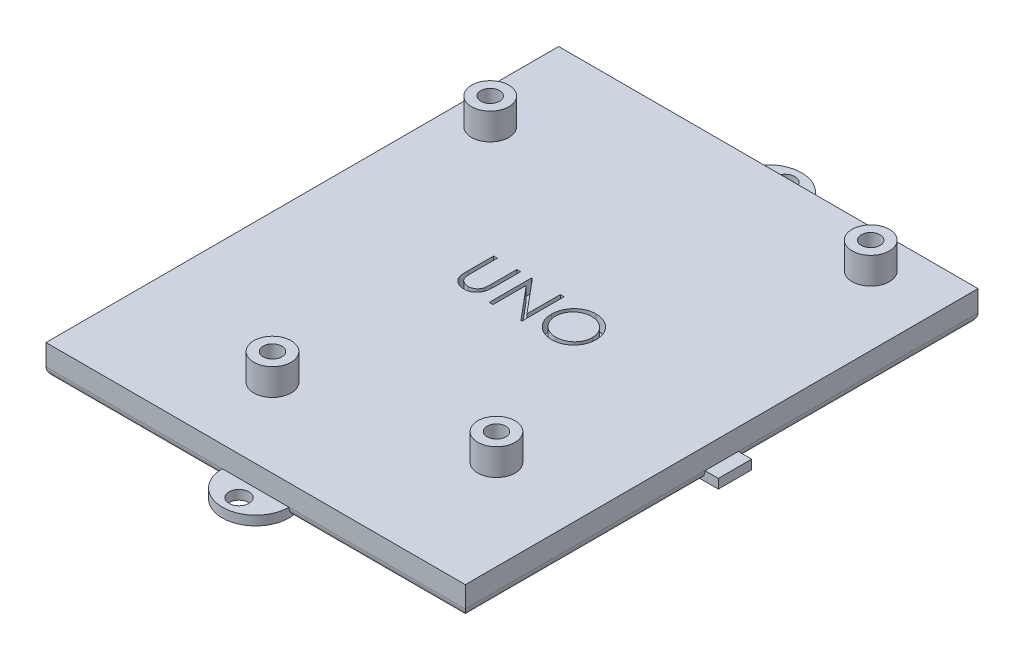
from build123d import *

# Parameters (mm, degrees)
SKETCH1_W           = 62.9
SKETCH1_H           = 76.9
BOSS_EXTRUDE1_DEPTH = 4.575
SKETCH2_R           = 2.7999972
SKETCH2_R_2         = 1.3999972
BOSS_EXTRUDE2_DEPTH = 4
CUT_EXTRUDE1_START  = -3.575
SKETCH3_R           = 1.3999972
CUT_EXTRUDE1_DEPTH  = 3.575
SKETCH4_R           = 1.5
BOSS_EXTRUDE3_DEPTH = 1.4
CUT_EXTRUDE2_DEPTH  = 2
SKETCH6_W           = 5
SKETCH6_H           = 1.4
BOSS_EXTRUDE4_DEPTH = 2
FILLET1_R           = 1.4


with BuildPart() as part:
    # Sketch1 → Boss-Extrude1 (new body)
    with BuildSketch(Plane(origin=(0, 0, 0), x_dir=(1, 0, 0), z_dir=(0, 1, 0))):
        Rectangle(SKETCH1_W, SKETCH1_H)
    extrude(amount=BOSS_EXTRUDE1_DEPTH)

    # Sketch2 → Boss-Extrude2 (add)
    # profile 1 of 4: a face of its own
    with BuildSketch(Plane(origin=(0, 4.575, 0), x_dir=(1, 0, 0), z_dir=(0, 1, 0))):
        with Locations(Location((17.897720407, -20.230856277, 0), (0, 0, 270))):
            Circle(SKETCH2_R)
        with Locations(Location((17.897720407, -20.230856277, 0), (0, 0, 270))):
            Circle(SKETCH2_R_2, mode=Mode.SUBTRACT)
    # profile 2 of 4: a face of its own
    with BuildSketch(Plane(origin=(0, 4.575, 0), x_dir=(1, 0, 0), z_dir=(0, 1, 0))):
        with Locations(Location((21.102904127, 32.70896236, 0), (0, 0, 270))):
            Circle(SKETCH2_R)
        with Locations(Location((21.102904127, 32.70896236, 0), (0, 0, 270))):
            Circle(SKETCH2_R_2, mode=Mode.SUBTRACT)
    # profile 3 of 4: a face of its own
    with BuildSketch(Plane(origin=(0, 4.575, 0), x_dir=(1, 0, 0), z_dir=(0, 1, 0))):
        with Locations(Location((-26.16610882, 22.896678476, 0), (0, 0, 270))):
            Circle(SKETCH2_R)
        with Locations(Location((-26.16610882, 22.896678476, 0), (0, 0, 270))):
            Circle(SKETCH2_R_2, mode=Mode.SUBTRACT)
    # profile 4 of 4: a face of its own
    with BuildSketch(Plane(origin=(0, 4.575, 0), x_dir=(1, 0, 0), z_dir=(0, 1, 0))):
        with Locations(Location((-9.300220478, -26.627387496, 0), (0, 0, 270))):
            Circle(SKETCH2_R)
        with Locations(Location((-9.300220478, -26.627387496, 0), (0, 0, 270))):
            Circle(SKETCH2_R_2, mode=Mode.SUBTRACT)
    extrude(amount=BOSS_EXTRUDE2_DEPTH)

    # Sketch3 → Cut-Extrude1 (cut)
    with BuildSketch(Plane(origin=(0, 4.575, 0), x_dir=(1, 0, 0), z_dir=(0, 1, 0)).offset(CUT_EXTRUDE1_START)):
        with Locations(Location((17.897720407, -20.230856277, 0), (0, 0, 270))):
            Circle(SKETCH3_R)
        with Locations(Location((-9.300220478, -26.627387496, 0), (0, 0, 270))):
            Circle(SKETCH3_R)
        with Locations(Location((-26.16610882, 22.896678476, 0), (0, 0, 270))):
            Circle(SKETCH3_R)
        with Locations(Location((21.102904127, 32.70896236, 0), (0, 0, 270))):
            Circle(SKETCH3_R)
    extrude(amount=CUT_EXTRUDE1_DEPTH, mode=Mode.SUBTRACT)

    # Sketch4 → Boss-Extrude3 (add)
    with BuildSketch(Plane(origin=(0, 0, 0), x_dir=(1, 0, 0), z_dir=(0, 1, 0))):
        with BuildLine():
            Line((-5, -38.45), (5, -38.45))
            ThreePointArc((5, -38.45), (0, -43.45), (-5, -38.45))
        make_face()
        with Locations(Location((0, -40.95, 0), (0, 0, 270))):
            Circle(SKETCH4_R, mode=Mode.SUBTRACT)
    boss_extrude3 = extrude(amount=BOSS_EXTRUDE3_DEPTH)

    # Mirror1: Boss-Extrude3 across plane
    add(boss_extrude3.mirror(Plane.XY))

    # Sketch5 → Cut-Extrude2 (cut)
    # profile 1 of 3: a face of its own
    with BuildSketch(Plane(origin=(0, 4.575, 0), x_dir=(1, 0, 0), z_dir=(0, 1, 0))):
        with BuildLine():
            Line((-9.117948718, 6.35), (-8.548076923, 6.35))
            Line((-8.548076923, 6.35), (-8.548076923, 2.545342548))
            add(Edge.make_bspline(
                [(-8.548076923, 2.545342548), (-8.54816173, 2.491493213), (-8.548322666, 2.389304821), (-8.547247676, 2.243856618), (-8.544237108, 2.114548014), (-8.542339076, 2.000880569), (-8.538116628, 1.90337587), (-8.534673028, 1.821505663), (-8.530245161, 1.75565761), (-8.524923648, 1.717229359), (-8.522636218, 1.700711138)],
                knots=[0, 0, 0, 0, 1.528628734, 2.90083645, 4.128790002, 5.200304208, 6.127813768, 6.898992206, 7.526736466, 8, 8, 8, 8], degree=3))
            add(Edge.make_bspline(
                [(-8.522636218, 1.700711138), (-8.513242828, 1.641117724), (-8.494985333, 1.525288773), (-8.448455476, 1.360355176), (-8.383472296, 1.211708102), (-8.30646849, 1.074709045), (-8.204990752, 0.953171206), (-8.083427195, 0.841208636), (-7.93614753, 0.743288362), (-7.772389002, 0.653751889), (-7.595885785, 0.581788096), (-7.415525345, 0.527371564), (-7.234018797, 0.494208417), (-7.112504898, 0.490368411), (-7.052163462, 0.488461538)],
                knots=[0, 0, 0, 0, 1.035780045, 2.013197591, 2.933192213, 3.817615948, 4.702609284, 5.640816605, 6.646850145, 7.73207398, 8.84249596, 9.914020372, 10.964143139, 12, 12, 12, 12], degree=3))
            add(Edge.make_bspline(
                [(-7.052163462, 0.488461538), (-7.000358818, 0.49040981), (-6.897048742, 0.494295099), (-6.743548503, 0.518355124), (-6.594051163, 0.561717579), (-6.447818501, 0.617669712), (-6.310747429, 0.691597485), (-6.18276147, 0.776997436), (-6.068526904, 0.87716574), (-5.964281679, 0.988019222), (-5.87350401, 1.113095716), (-5.794816367, 1.249671767), (-5.730362181, 1.399802725), (-5.698533214, 1.505311462), (-5.68218149, 1.559515224)],
                knots=[0, 0, 0, 0, 0.994687771, 1.983630487, 2.973142513, 3.978332533, 4.983357753, 5.956394766, 6.925816176, 7.893390482, 8.871859704, 9.88551698, 10.913711441, 12, 12, 12, 12], degree=3))
            add(Edge.make_bspline(
                [(-5.68218149, 1.559515224), (-5.676738406, 1.581919066), (-5.66460902, 1.631843855), (-5.653275096, 1.716246768), (-5.6414704, 1.815831757), (-5.63327968, 1.931314332), (-5.625294608, 2.062307525), (-5.620517462, 2.209493735), (-5.618309417, 2.372338506), (-5.617651411, 2.485980214), (-5.617307692, 2.545342548)],
                knots=[0, 0, 0, 0, 0.558680831, 1.244966039, 2.062412453, 2.990489873, 4.051219941, 5.244515665, 6.560634259, 8, 8, 8, 8], degree=3))
            Line((-5.617307692, 2.545342548), (-5.617307692, 6.35))
            Line((-5.617307692, 6.35), (-5.047435897, 6.35))
            Line((-5.047435897, 6.35), (-5.047435897, 2.514813702))
            add(Edge.make_bspline(
                [(-5.047435897, 2.514813702), (-5.047896944, 2.445692357), (-5.048796706, 2.310797851), (-5.05659918, 2.113128956), (-5.069039737, 1.925617119), (-5.086616697, 1.748237132), (-5.109906688, 1.581623729), (-5.135806017, 1.424316507), (-5.168788884, 1.277444649), (-5.20731234, 1.139862977), (-5.251351492, 1.008897831), (-5.308394718, 0.88460363), (-5.372664882, 0.763201791), (-5.448891467, 0.646528507), (-5.534546404, 0.53406719), (-5.631523025, 0.426499868), (-5.736614002, 0.322107598), (-5.851566346, 0.223568178), (-5.974485156, 0.133201007), (-6.105004794, 0.053739337), (-6.242122647, -0.013432083), (-6.38548229, -0.068724118), (-6.535144901, -0.110297748), (-6.691114254, -0.141276959), (-6.853745362, -0.158879699), (-6.964352667, -0.161495772), (-7.02036258, -0.162820513)],
                knots=[0, 0, 0, 0, 1.316592851, 2.569410997, 3.76748051, 4.895814652, 5.963796859, 6.97159953, 7.931736103, 8.829262218, 9.692595152, 10.560224239, 11.431080259, 12.30701507, 13.211635791, 14.121146779, 15.063487852, 16.031507147, 17.00238618, 17.966455255, 18.938106653, 19.907068911, 20.888905087, 21.893141452, 22.933117798, 24, 24, 24, 24], degree=3))
            add(Edge.make_bspline(
                [(-7.02036258, -0.162820513), (-7.081447952, -0.161396724), (-7.201297233, -0.158603257), (-7.377896298, -0.142596267), (-7.547194911, -0.112445752), (-7.710981145, -0.074055568), (-7.867025133, -0.02110793), (-8.017417525, 0.04075581), (-8.159582561, 0.116733125), (-8.29582658, 0.201266853), (-8.422508637, 0.296380125), (-8.53879964, 0.400048726), (-8.644891577, 0.510611982), (-8.738996212, 0.629266932), (-8.822672674, 0.755090743), (-8.894754632, 0.888439364), (-8.956645804, 1.029261166), (-8.988589147, 1.127147687), (-9.00473758, 1.176632612)],
                knots=[0, 0, 0, 0, 1.13879206, 2.234305948, 3.301075583, 4.341971843, 5.366689343, 6.369221514, 7.369726634, 8.367512178, 9.355451585, 10.318319045, 11.268648973, 12.207971039, 13.137398894, 14.081662264, 15.030215811, 16, 16, 16, 16], degree=3))
            add(Edge.make_bspline(
                [(-9.00473758, 1.176632612), (-9.014130424, 1.210437426), (-9.034503712, 1.283760819), (-9.056321038, 1.40511202), (-9.0746618, 1.544839085), (-9.091907599, 1.702951578), (-9.102083851, 1.879572051), (-9.11100549, 2.074623941), (-9.11801157, 2.2883431), (-9.117970254, 2.437213435), (-9.117948718, 2.514813702)],
                knots=[0, 0, 0, 0, 0.625038921, 1.35572334, 2.194682327, 3.136881307, 4.189498639, 5.346923369, 6.617055217, 8, 8, 8, 8], degree=3))
            Line((-9.117948718, 2.514813702), (-9.117948718, 6.35))
        make_face()
    # profile 2 of 3: a face of its own
    with BuildSketch(Plane(origin=(0, 4.575, 0), x_dir=(1, 0, 0), z_dir=(0, 1, 0))):
        Polygon((-3.419230769, 0), (-3.419230769, 6.35), (-3.299659455, 6.35), (0.895512821, 1.352173478), (0.895512821, 6.35), (1.465384615, 6.35), (1.465384615, 0), (1.335637019, 0), (-2.849358974, 4.986378205), (-2.849358974, 0), align=None)
    # profile 3 of 3: a face of its own
    with BuildSketch(Plane(origin=(0, 4.575, 0), x_dir=(1, 0, 0), z_dir=(0, 1, 0))):
        with BuildLine():
            add(Edge.make_bspline(
                [(6.065064103, 6.512820513), (6.182644523, 6.5098424), (6.41358217, 6.503993141), (6.752989485, 6.459218196), (7.077012015, 6.38175656), (7.388289267, 6.278590864), (7.683097953, 6.140969336), (7.963657086, 5.974626281), (8.229299129, 5.777818991), (8.476443635, 5.552068823), (8.702606959, 5.306444556), (8.901862496, 5.044320348), (9.068853515, 4.767281093), (9.205987728, 4.4761593), (9.313572349, 4.171613358), (9.387811185, 3.852019667), (9.435233258, 3.519448958), (9.440777311, 3.292614503), (9.443589744, 3.177544071)],
                knots=[0, 0, 0, 0, 1.065120563, 2.091984664, 3.0946048, 4.079830382, 5.057816894, 6.036188127, 7.030412546, 8.04752943, 9.064399622, 10.05169764, 11.02544977, 11.989514704, 12.962713494, 13.945757189, 14.957906945, 16, 16, 16, 16], degree=3))
            add(Edge.make_bspline(
                [(9.443589744, 3.177544071), (9.440777723, 3.063321275), (9.435234905, 2.838174912), (9.387757266, 2.507714663), (9.313297166, 2.190050114), (9.206986797, 1.885711573), (9.070506286, 1.594377993), (8.902403333, 1.316815948), (8.704389994, 1.052934444), (8.479043278, 0.805624322), (8.233387102, 0.578843197), (7.969897903, 0.381233237), (7.694501452, 0.211190896), (7.403653838, 0.075511945), (7.101212343, -0.032931396), (6.784470128, -0.106868311), (6.45491138, -0.154560518), (6.230173987, -0.160036968), (6.115945513, -0.162820513)],
                knots=[0, 0, 0, 0, 1.043624062, 2.057103931, 3.04512605, 4.022047818, 4.998200453, 5.980619268, 6.982898556, 8.009068085, 9.034988726, 10.034168286, 11.015286542, 11.987931943, 12.962482838, 13.94673481, 14.956375938, 16, 16, 16, 16], degree=3))
            add(Edge.make_bspline(
                [(6.115945513, -0.162820513), (6.000875677, -0.160009482), (5.774042399, -0.154468193), (5.441053778, -0.106967644), (5.121235586, -0.032688422), (4.815502406, 0.073464412), (4.523683748, 0.210655674), (4.245208883, 0.377940762), (3.981195573, 0.576436575), (3.73383269, 0.801710217), (3.507502002, 1.046950033), (3.310181421, 1.309720753), (3.142858715, 1.584867082), (3.006128098, 1.87315259), (2.897879721, 2.173183636), (2.824029551, 2.486961588), (2.77624861, 2.812697548), (2.770742531, 3.034481092), (2.767948718, 3.147015224)],
                knots=[0, 0, 0, 0, 1.053102029, 2.075944431, 3.073151272, 4.055350789, 5.033113405, 6.020478099, 7.024410459, 8.052272461, 9.079885166, 10.07527673, 11.055994387, 12.023226415, 12.992069828, 13.970394897, 14.97016774, 16, 16, 16, 16], degree=3))
            add(Edge.make_bspline(
                [(2.767948718, 3.147015224), (2.7689187, 3.222548781), (2.770846426, 3.372663005), (2.794054211, 3.595578123), (2.82773044, 3.814908316), (2.87599391, 4.030029893), (2.939115934, 4.240416251), (3.013596041, 4.447518349), (3.104564046, 4.649237391), (3.207398936, 4.846528973), (3.322173931, 5.036317602), (3.448948505, 5.215713417), (3.583269816, 5.386221797), (3.730523402, 5.543424219), (3.885856095, 5.691893852), (4.051787724, 5.829349067), (4.227305796, 5.957029336), (4.413165542, 6.072091954), (4.60478727, 6.176157813), (4.802320852, 6.265460314), (5.003083489, 6.34210674), (5.208015493, 6.40422938), (5.416572665, 6.453273217), (5.629210189, 6.486669416), (5.845758662, 6.509936392), (5.991647769, 6.511855003), (6.065064103, 6.512820513)],
                knots=[0, 0, 0, 0, 1.037015668, 2.060948919, 3.074880161, 4.083647147, 5.086022904, 6.090072063, 7.104153813, 8.122640571, 9.144368836, 10.147691507, 11.138137339, 12.123020368, 13.103399296, 14.087645067, 15.080126199, 16.082011238, 17.087798457, 18.072939717, 19.057185487, 20.037253025, 21.01195951, 21.997135196, 22.992090687, 24, 24, 24, 24], degree=3))
        make_face()
        with BuildLine():
            add(Edge.make_bspline(
                [(6.093048878, 5.861538462), (6.032788043, 5.860803875), (5.91284247, 5.859341724), (5.73452624, 5.840081783), (5.55855516, 5.812631842), (5.384892889, 5.773476797), (5.21426605, 5.720129444), (5.045084195, 5.658732368), (4.878890083, 5.583945532), (4.71623237, 5.49944934), (4.55854359, 5.405924869), (4.409749118, 5.302561806), (4.269463749, 5.191784144), (4.138030966, 5.073333353), (4.015836696, 4.946606218), (3.900475881, 4.813523941), (3.796572497, 4.670282653), (3.701348664, 4.520766629), (3.616135583, 4.365170618), (3.540361296, 4.205132725), (3.478378023, 4.039347493), (3.427827712, 3.869613521), (3.385918055, 3.69619963), (3.359367936, 3.517790305), (3.339896369, 3.33528203), (3.338517793, 3.211943523), (3.337820513, 3.149559295)],
                knots=[0, 0, 0, 0, 1.008559885, 2.007477868, 2.99961109, 3.989939068, 4.984837346, 5.991145699, 7.001802488, 8.033829008, 9.059044045, 10.069351652, 11.065060232, 12.050310815, 13.029377138, 14.011219647, 14.996725999, 15.989392538, 16.977580475, 17.965360261, 18.951710183, 19.937753436, 20.929683414, 21.935841486, 22.955955122, 24, 24, 24, 24], degree=3))
            add(Edge.make_bspline(
                [(3.337820513, 3.149559295), (3.340133477, 3.05782498), (3.344683792, 2.877355204), (3.384521098, 2.612890143), (3.445883823, 2.358729966), (3.536339331, 2.116265359), (3.64946116, 1.88341216), (3.789209947, 1.662236027), (3.954780002, 1.452677184), (4.142855257, 1.256198625), (4.348455025, 1.076864094), (4.566772978, 0.919450481), (4.795470237, 0.786263314), (5.035143191, 0.677759825), (5.284512297, 0.591781301), (5.545184426, 0.532855784), (5.815423116, 0.494074601), (5.999628734, 0.490350315), (6.093048878, 0.488461538)],
                knots=[0, 0, 0, 0, 1.032063989, 2.030389145, 3.003944642, 3.970395727, 4.937377036, 5.913328081, 6.909231446, 7.93887556, 8.970685674, 9.976071282, 10.964166581, 11.944589148, 12.933237628, 13.927779006, 14.949070134, 16, 16, 16, 16], degree=3))
            add(Edge.make_bspline(
                [(6.093048878, 0.488461538), (6.155840403, 0.489324239), (6.280374854, 0.491035234), (6.465605302, 0.508268548), (6.647498715, 0.535903511), (6.825799965, 0.575691986), (7.000306695, 0.62548906), (7.171747266, 0.684648795), (7.338295593, 0.758456122), (7.502052727, 0.840004549), (7.658800194, 0.932968834), (7.808434374, 1.032823763), (7.947183652, 1.143438261), (8.07851811, 1.260129149), (8.20121406, 1.385249273), (8.314441788, 1.518635961), (8.417820028, 1.661131154), (8.513007701, 1.81042039), (8.597922192, 1.966442163), (8.671907129, 2.127060293), (8.734674368, 2.291879277), (8.785344655, 2.461136842), (8.825051136, 2.634511525), (8.852410419, 2.812235467), (8.871548301, 2.993953131), (8.872990798, 3.116859841), (8.873717949, 3.178816106)],
                knots=[0, 0, 0, 0, 1.047197238, 2.076906641, 3.100256066, 4.114471768, 5.12198147, 6.126382909, 7.136867548, 8.15857795, 9.17633901, 10.174870724, 11.156907918, 12.133735059, 13.104061851, 14.077631395, 15.04955518, 16.038496417, 17.029181396, 18.010275684, 18.986308667, 19.968651475, 20.955262928, 21.950658345, 22.966943676, 24, 24, 24, 24], degree=3))
            add(Edge.make_bspline(
                [(8.873717949, 3.178816106), (8.872990215, 3.240348521), (8.871546622, 3.3624094), (8.852419561, 3.542859742), (8.825022231, 3.719304854), (8.785538461, 3.89105204), (8.734647467, 4.058145078), (8.671896168, 4.220427035), (8.597899982, 4.378502474), (8.512976489, 4.531980699), (8.417516352, 4.679254866), (8.313205368, 4.820047815), (8.198242522, 4.951715503), (8.075912448, 5.077508448), (7.943159556, 5.194743762), (7.800585194, 5.303460335), (7.649920236, 5.406281847), (7.490395109, 5.499038223), (7.32575965, 5.584698331), (7.156824326, 5.658088008), (6.98550296, 5.720448853), (6.812231213, 5.773638204), (6.635550667, 5.812478488), (6.456655148, 5.840106521), (6.275792165, 5.859335021), (6.154156609, 5.860801651), (6.093048878, 5.861538462)],
                knots=[0, 0, 0, 0, 1.02996197, 2.043119294, 3.035359645, 4.018872909, 4.991431989, 5.957985074, 6.929999688, 7.912076566, 8.892894881, 9.867085534, 10.843653904, 11.817741046, 12.803660682, 13.806313499, 14.818574707, 15.856120519, 16.894564902, 17.924820532, 18.937903209, 19.946497019, 20.957711757, 21.963978472, 22.977135795, 24, 24, 24, 24], degree=3))
        make_face(mode=Mode.SUBTRACT)
    extrude(amount=-CUT_EXTRUDE2_DEPTH, mode=Mode.SUBTRACT)

    # Sketch6 → Boss-Extrude4 (add)
    with BuildSketch(Plane.ZY.offset(31.45)):
        with Locations((0, 0.7)):
            Rectangle(SKETCH6_W, SKETCH6_H)
    boss_extrude4 = extrude(amount=BOSS_EXTRUDE4_DEPTH)

    # Mirror2: Boss-Extrude4 across plane
    add(boss_extrude4.mirror(Plane(origin=(0, 0, 0), x_dir=(0, 0, 1), z_dir=(1, 0, 0))))

    # Fillet1
    fillet1_edges = [part.edges().sort_by_distance(p)[0] for p in [
        (-18.225, 0, 38.45),
        (18.225, 0, 38.45),
        (31.45, 0, -20.475),
        (31.45, 0, 20.475),
        (18.225, 0, -38.45),
        (-18.225, 0, -38.45),
        (-31.45, 0, 20.475),
        (-31.45, 0, -20.475),
    ]]
    fillet(fillet1_edges, radius=FILLET1_R)


solid = part.part
